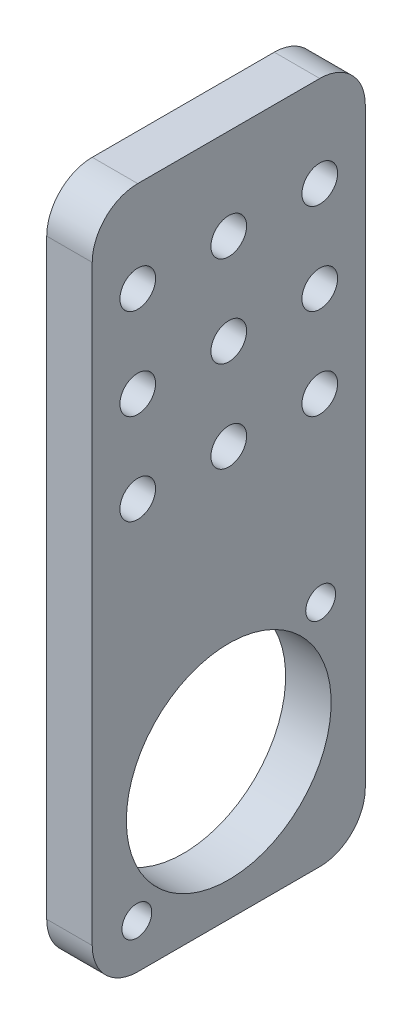
from build123d import *

# Parameters (mm, degrees)
SKETCH1_R           = 2.0828
SKETCH1_R_2         = 14.2875
SKETCH1_R_3         = 2.4892
BOSS_EXTRUDE1_DEPTH = 6.35


with BuildPart() as part:
    # Sketch1 → Boss-Extrude1 (new body)
    with BuildSketch(Plane(origin=(95.25, 0, 0), x_dir=(0, 0, -1), z_dir=(1, 0, 0))):
        with BuildLine():
            Line((-184.15, -107.95), (-184.15, -25.4))
            ThreePointArc((-184.15, -25.4), (-186.009871939, -20.909871939), (-190.5, -19.05))
            Line((-190.5, -19.05), (-215.9, -19.05))
            ThreePointArc((-215.9, -19.05), (-220.390128061, -20.909871939), (-222.25, -25.4))
            Line((-222.25, -25.4), (-222.25, -107.95))
            ThreePointArc((-222.25, -107.95), (-220.390128061, -112.440128061), (-215.9, -114.3))
            Line((-215.9, -114.3), (-190.5, -114.3))
            ThreePointArc((-190.5, -114.3), (-186.009871939, -112.440128061), (-184.15, -107.95))
        make_face()
        with Locations(Location((-190.376194259, -82.426194259, 0), (0, 0, 180))):
            Circle(SKETCH1_R, mode=Mode.SUBTRACT)
        with Locations(Location((-216.023805741, -108.073805741, 0), (0, 0, 180))):
            Circle(SKETCH1_R, mode=Mode.SUBTRACT)
        with Locations(Location((-203.2, -95.25, 0), (0, 0, 180))):
            Circle(SKETCH1_R_2, mode=Mode.SUBTRACT)
        with Locations(Location((-215.9, -31.75, 0), (0, 0, 180))):
            Circle(SKETCH1_R_3, mode=Mode.SUBTRACT)
        with Locations(Location((-203.2, -31.75, 0), (0, 0, 180))):
            Circle(SKETCH1_R_3, mode=Mode.SUBTRACT)
        with Locations(Location((-190.5, -31.75, 0), (0, 0, 180))):
            Circle(SKETCH1_R_3, mode=Mode.SUBTRACT)
        with Locations(Location((-215.9, -57.15, 0), (0, 0, 180))):
            Circle(SKETCH1_R_3, mode=Mode.SUBTRACT)
        with Locations(Location((-203.2, -57.15, 0), (0, 0, 180))):
            Circle(SKETCH1_R_3, mode=Mode.SUBTRACT)
        with Locations(Location((-190.5, -57.15, 0), (0, 0, 180))):
            Circle(SKETCH1_R_3, mode=Mode.SUBTRACT)
        with Locations(Location((-215.9, -44.45, 0), (0, 0, 180))):
            Circle(SKETCH1_R_3, mode=Mode.SUBTRACT)
        with Locations(Location((-203.2, -44.45, 0), (0, 0, 180))):
            Circle(SKETCH1_R_3, mode=Mode.SUBTRACT)
        with Locations(Location((-190.5, -44.45, 0), (0, 0, 180))):
            Circle(SKETCH1_R_3, mode=Mode.SUBTRACT)
    extrude(amount=-BOSS_EXTRUDE1_DEPTH)


solid = part.part
